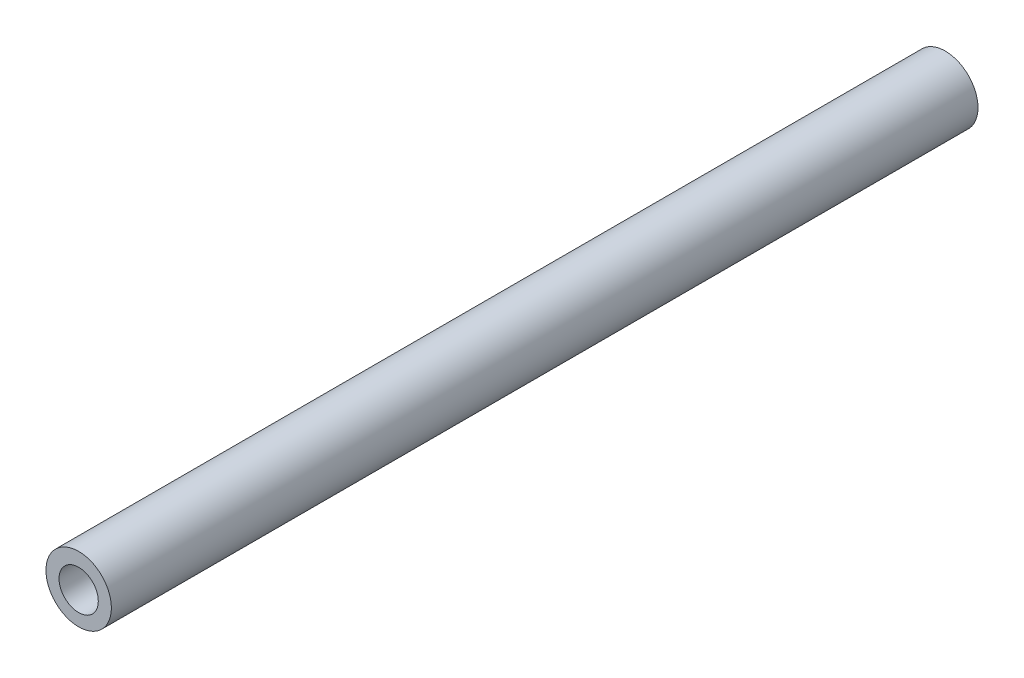
from build123d import *

# Parameters (mm, degrees)
SKETCH1_R           = 5
SKETCH1_R_2         = 3
BOSS_EXTRUDE1_DEPTH = 132.4


with BuildPart() as part:
    # Sketch1 → Boss-Extrude1 (new body)
    with BuildSketch(Plane.XY):
        with Locations((0.052288579, 0.183010026)):
            Circle(SKETCH1_R)
        with Locations((0.052288579, 0.078432868)):
            Circle(SKETCH1_R_2, mode=Mode.SUBTRACT)
    extrude(amount=BOSS_EXTRUDE1_DEPTH)


solid = part.part
